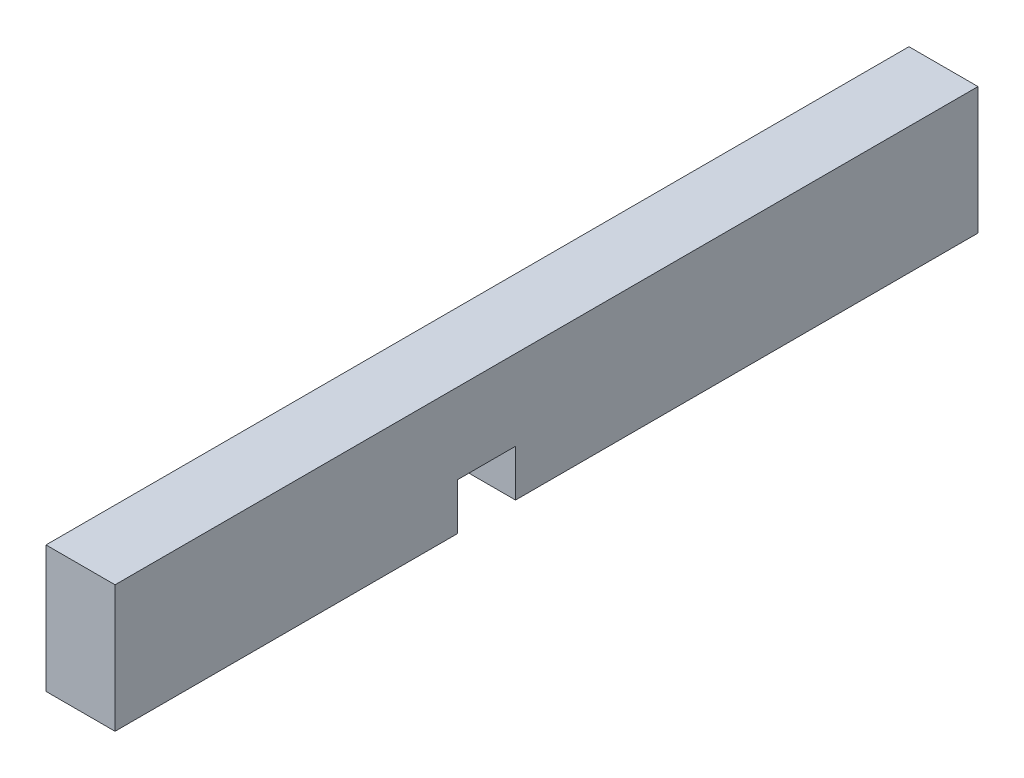
from build123d import *

# Parameters (mm, degrees)
SKETCH1_W           = 58.7248
SKETCH1_H           = 8.636
BOSS_EXTRUDE1_DEPTH = 2.3495
SKETCH2_W           = 3.9624
SKETCH2_H           = 3.175
CUT_EXTRUDE1_DEPTH  = 4.699


with BuildPart() as part:
    # Sketch1 → Boss-Extrude1 (new, symmetric)
    with BuildSketch(Plane(origin=(0, 0, 0), x_dir=(0, 0, -1), z_dir=(1, 0, 0))):
        Rectangle(SKETCH1_W, SKETCH1_H)
    extrude(amount=BOSS_EXTRUDE1_DEPTH, both=True)

    # Sketch2 → Cut-Extrude1 (cut)
    with BuildSketch(Plane(origin=(2.3495, 0, 0), x_dir=(0, 0, -1), z_dir=(1, 0, 0))):
        with Locations((-4.089773034, -2.7305)):
            Rectangle(SKETCH2_W, SKETCH2_H)
    extrude(amount=-CUT_EXTRUDE1_DEPTH, mode=Mode.SUBTRACT)


solid = part.part
